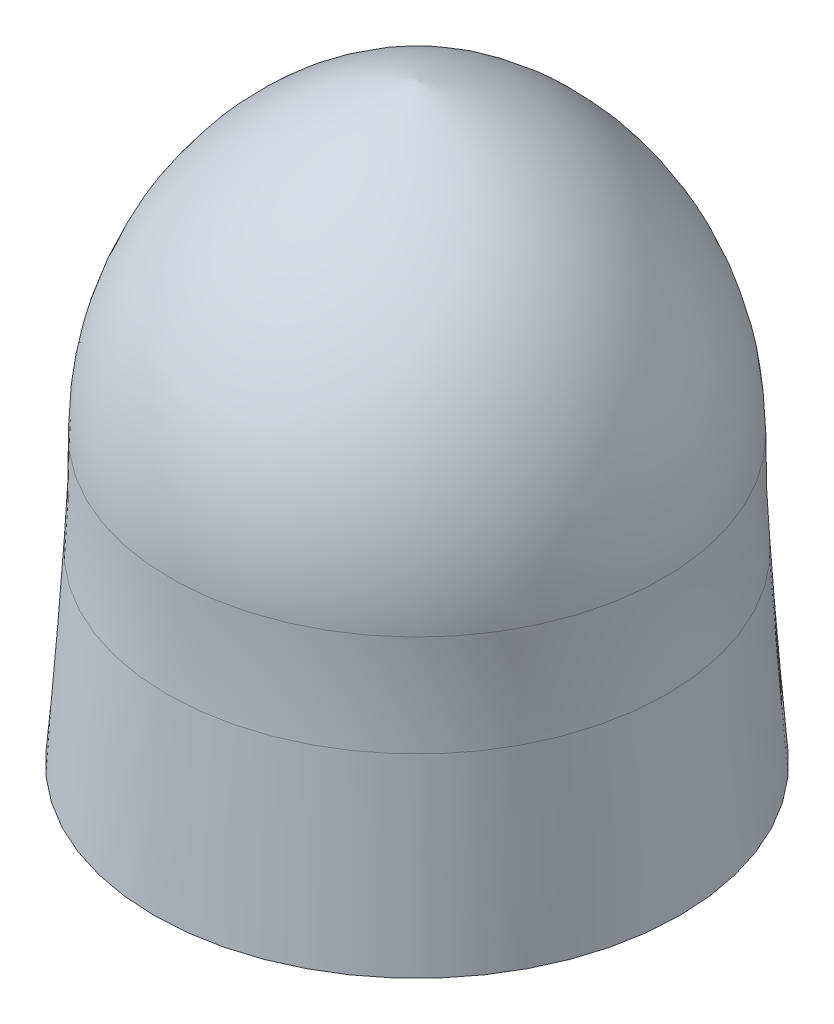
from build123d import *

# Parameters (mm, degrees)
FILLET1_R = 200


with BuildPart() as part:
    # Sketch1 → Revolve2 (revolve)
    with BuildSketch(Plane.XY):
        with BuildLine():
            Line((-37.297161284, -51.34760557), (-40, -90))
            Line((-40, -90), (0, -90))
            Line((0, -90), (0, 0))
            ThreePointArc((0, 0), (-28.469277641, -18.540381161), (-37.297161284, -51.34760557))
        make_face()
    revolve(axis=Axis((0, 0, 0), (0, -1, 0)))

    # Fillet1
    fillet1_edges = [part.edges().sort_by_distance(p)[0] for p in [
        (37.297161284, -51.34760557, 0),
    ]]
    fillet(fillet1_edges, radius=FILLET1_R)


solid = part.part
